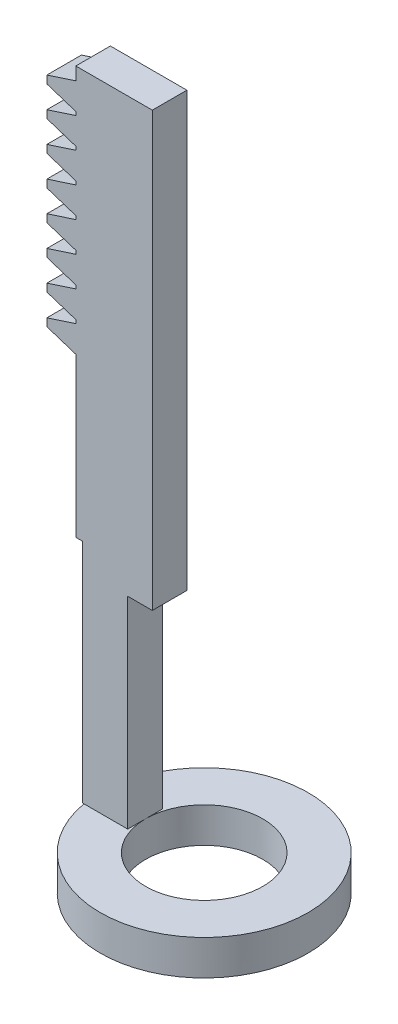
from build123d import *

# Parameters (mm, degrees)
BOSS_EXTRUDE1_DEPTH = 6.1
SKETCH3_R           = 18.340849868
SKETCH3_R_2         = 10.340849868
BOSS_EXTRUDE2_DEPTH = 6.2


with BuildPart() as part:
    # Sketch2 → Boss-Extrude1 (new body)
    with BuildSketch(Plane.XY):
        Polygon((9.301598931, 56.02003156), (-4.198401069, 56.02003156), (-4.198401069, 48.443721), (-4.198401069, -16.02003156), (-3.039250937, -16.02003156), (-3.039250937, -56.02003156), (4.960749063, -56.02003156), (4.960749063, -20.437234175), (9.301598931, -20.437234175), (9.301598931, 48.443721), align=None)
        Polygon((-4.198401069, 49.063721), (-4.198401069, 53.74676634), (-9.301598931, 52.089011931), (-9.301598931, 50.721475409), align=None)
        Polygon((-4.198401069, 43.76067566), (-4.198401069, 48.443721), (-9.301598931, 46.785966591), (-9.301598931, 45.418430069), align=None)
        Polygon((-4.198401069, 38.46067566), (-4.198401069, 43.143721), (-9.301598931, 41.485966591), (-9.301598931, 40.118430069), align=None)
        Polygon((-4.198401069, 33.16067566), (-4.198401069, 37.843721), (-9.301598931, 36.185966591), (-9.301598931, 34.818430069), align=None)
        Polygon((-4.198401069, 27.86067566), (-4.198401069, 32.543721), (-9.301598931, 30.885966591), (-9.301598931, 29.518430069), align=None)
        Polygon((-9.301598931, 24.218430069), (-4.198401069, 22.56067566), (-4.198401069, 27.243721), (-9.301598931, 25.585966591), align=None)
        Polygon((-9.301598931, 18.918430069), (-4.198401069, 17.26067566), (-4.198401069, 21.943721), (-9.301598931, 20.285966591), align=None)
        Polygon((-9.301598931, 13.618430069), (-4.198401069, 11.96067566), (-4.198401069, 16.643721), (-9.301598931, 14.985966591), align=None)
    extrude(amount=BOSS_EXTRUDE1_DEPTH)

    # Sketch3 → Boss-Extrude2 (add)
    with BuildSketch(Plane.XZ.offset(56.02003156)):
        with Locations(Location((15.301598931, 2.942643244, 0), (0, 0, 170.087216978))):
            Circle(SKETCH3_R)
        with Locations(Location((15.301598931, 2.942643244, 0), (0, 0, 180))):
            Circle(SKETCH3_R_2, mode=Mode.SUBTRACT)
    extrude(amount=BOSS_EXTRUDE2_DEPTH)


solid = part.part
